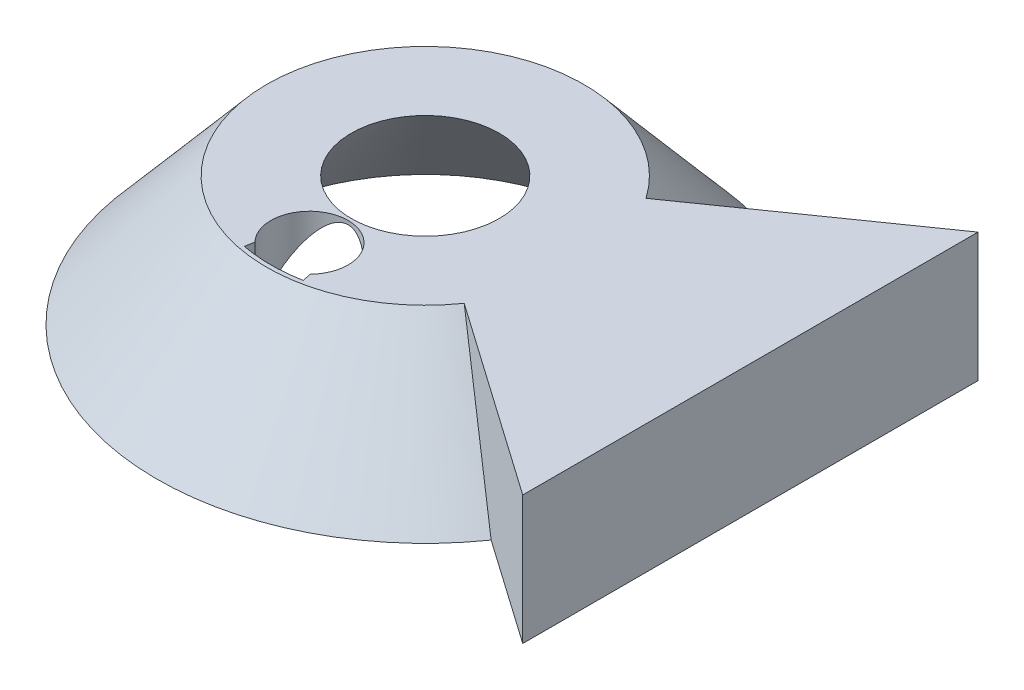
from build123d import *

# Parameters (mm, degrees)
REVOLVE2_ANGLE          = 70
CUT_EXTRUDE1_DEPTH      = 78.096292231
CUT_EXTRUDE1_DEPTH_BACK = 78.096292231
SKETCH4_W               = 54.680091263
SKETCH4_H               = 66.719762054
SKETCH5_R               = 6
CUT_EXTRUDE2_DEPTH      = 40
CUT_REVOLVE1_ANGLE      = 22


with BuildPart() as part:
    # Sketch1 → Revolve1 (revolve)
    with BuildSketch(Plane(origin=(0, 0, 0), x_dir=(0, 0, -1), z_dir=(1, 0, 0))):
        Polygon((11.5, 20), (28.55, 0), (41.690609765, 0), (24.640609765, 20), align=None)
    revolve(axis=Axis((0, 0, 0), (0, 1, 0)))

    # Sketch3 → Revolve2 (revolve, symmetric)
    with BuildSketch(Plane.XY) as revolve2_sk:
        Polygon((24.640609765, 20), (61.690609765, 20), (61.690609765, 0), (41.690609765, 0), align=None)
    revolve(axis=Axis((0, 0, 0), (0, 1, 0)), revolution_arc=REVOLVE2_ANGLE / 2)
    revolve(revolve2_sk.sketch, axis=Axis((0, 0, 0), (0, -1, 0)), revolution_arc=REVOLVE2_ANGLE / 2)

    # Sketch4 → Cut-Extrude1 (cut, two sides: drawn at the far end of the back side and taken through both)
    with BuildSketch(Plane.XY.offset(-CUT_EXTRUDE1_DEPTH_BACK)):
        with Locations((77.874034735, 12.769248077)):
            Rectangle(SKETCH4_W, SKETCH4_H)
    extrude(amount=CUT_EXTRUDE1_DEPTH + CUT_EXTRUDE1_DEPTH_BACK, mode=Mode.SUBTRACT)

    # Sketch5 → Cut-Extrude2 (cut)
    with BuildSketch(Plane(origin=(0, 0, 0), x_dir=(1, 0, 0), z_dir=(0, 1, 0))):
        with Locations(Location((0, -18, 0), (0, 0, 251.911143057))):
            Circle(SKETCH5_R)
    extrude(amount=CUT_EXTRUDE2_DEPTH, mode=Mode.SUBTRACT)

    # Sketch7 → Cut-Revolve1 (revolve, symmetric, cut)
    with BuildSketch(Plane(origin=(0, 0, 0), x_dir=(0, 0, -1), z_dir=(1, 0, 0))) as cut_revolve1_sk:
        Polygon((-43.736107379, -8.562897575), (-24, 14.94597317), (-24, 20), (-18.43156125, 20), (-18.70488034, 12.563709667), (-17.388176204, -8.562897575), align=None)
    revolve(axis=Axis((0, 0, 0), (0, 1, 0)), revolution_arc=CUT_REVOLVE1_ANGLE / 2, mode=Mode.SUBTRACT)
    revolve(cut_revolve1_sk.sketch, axis=Axis((0, 0, 0), (0, -1, 0)), revolution_arc=CUT_REVOLVE1_ANGLE / 2, mode=Mode.SUBTRACT)


solid = part.part
